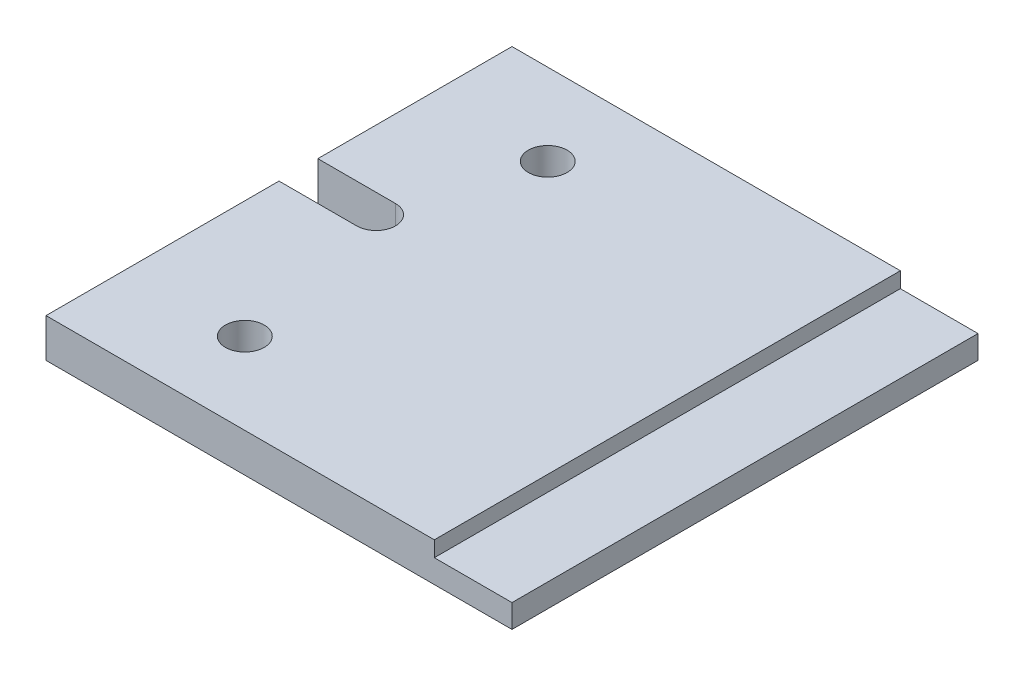
from build123d import *

# Parameters (mm, degrees)
SKETCH1_W           = 63.5
SKETCH1_H           = 76.2
SKETCH1_R           = 3.175
SKETCH1_W_2         = 12.7
BOSS_EXTRUDE1_DEPTH = 6.35
SKETCH2_W           = 12.7
SKETCH2_H           = 76.2
CUT_EXTRUDE1_DEPTH  = 2.54
CUT_EXTRUDE2_DEPTH  = 108.95


with BuildPart() as part:
    # Sketch1 → Boss-Extrude1 (new body)
    # profile 1 of 2: a face of its own
    with BuildSketch(Plane(origin=(0, 0, 0), x_dir=(1, 0, 0), z_dir=(0, 1, 0))):
        with Locations((31.75, 38.1)):
            Rectangle(SKETCH1_W, SKETCH1_H)
        with Locations(Location((19.177, 13.335, 0), (0, 0, 270))):
            Circle(SKETCH1_R, mode=Mode.SUBTRACT)
        with Locations(Location((19.177, 62.865, 0), (0, 0, 90))):
            Circle(SKETCH1_R, mode=Mode.SUBTRACT)
    # profile 2 of 2: a face of its own
    with BuildSketch(Plane(origin=(0, 0, 0), x_dir=(1, 0, 0), z_dir=(0, 1, 0))):
        with Locations((69.85, 38.1)):
            Rectangle(SKETCH1_W_2, SKETCH1_H)
    extrude(amount=BOSS_EXTRUDE1_DEPTH)

    # Sketch2 → Cut-Extrude1 (cut)
    with BuildSketch(Plane(origin=(0, 6.35, 0), x_dir=(1, 0, 0), z_dir=(0, 1, 0))):
        with Locations((69.85, 38.1)):
            Rectangle(SKETCH2_W, SKETCH2_H)
    extrude(amount=-CUT_EXTRUDE1_DEPTH, mode=Mode.SUBTRACT)

    # Sketch3 → Cut-Extrude2 (cut, through all)
    with BuildSketch(Plane(origin=(0, 6.35, 0), x_dir=(1, 0, 0), z_dir=(0, 1, 0))):
        with BuildLine():
            Line((0, 44.45), (12.7, 44.45))
            ThreePointArc((12.7, 44.45), (15.875, 41.275), (12.7, 38.1))
            Line((12.7, 38.1), (0, 38.1))
            Line((0, 38.1), (0, 44.45))
        make_face()
    extrude(amount=-CUT_EXTRUDE2_DEPTH, mode=Mode.SUBTRACT)


solid = part.part
